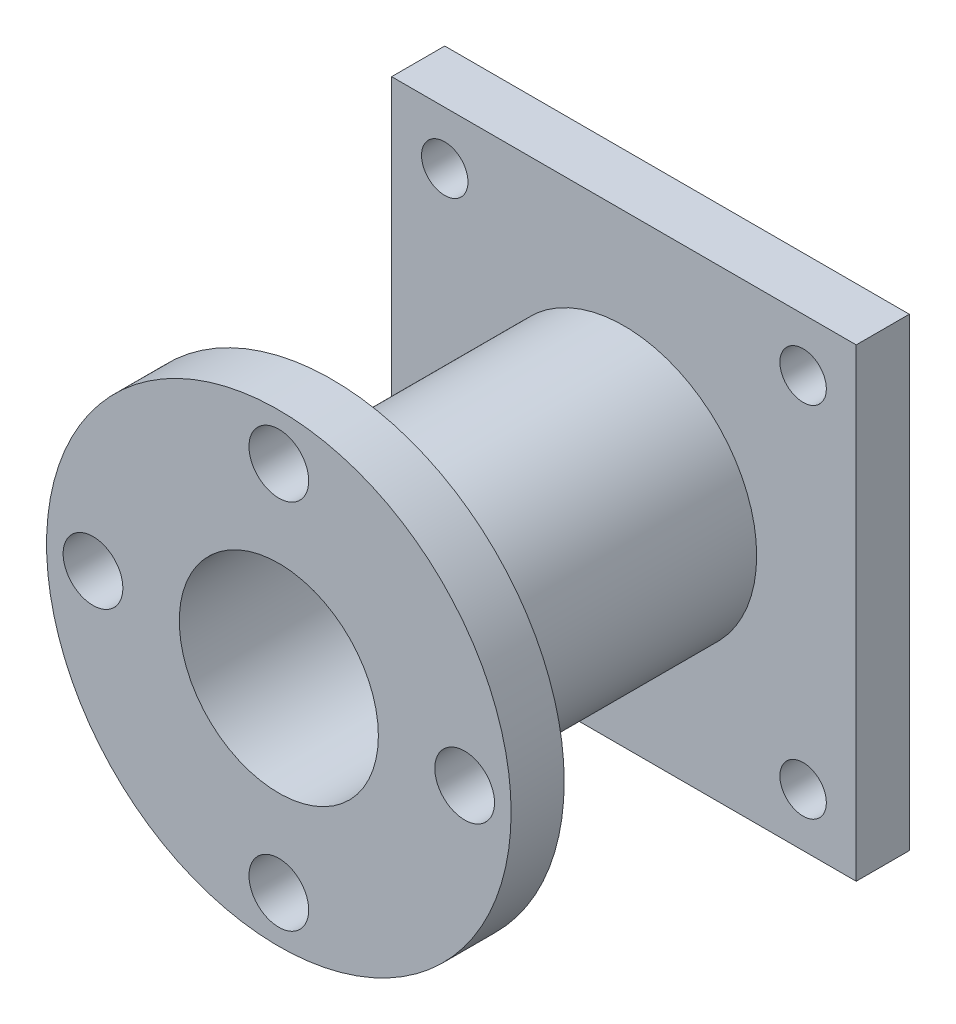
from build123d import *

# Parameters (mm, degrees)
SKETCH_1_R          = 20
EXTRUDE_1_DEPTH     = 60
SKETCH_2_W          = 70
SKETCH_2_H          = 70
EXTRUDE_2_DEPTH     = 8
SKETCH_3_R          = 35
EXTRUDE_3_DEPTH     = 8
SKETCH_4_R          = 15
CUT_EXTRUDE_1_DEPTH = 71
SKETCH_5_R          = 3.5
CUT_EXTRUDE_2_DEPTH = 8
SKETCH_6_R          = 4.5
CUT_EXTRUDE_3_DEPTH = 8


with BuildPart() as part:
    # 草图1 → 凸台-拉伸1 (new body)
    with BuildSketch(Plane.XY):
        Circle(SKETCH_1_R)
    extrude(amount=EXTRUDE_1_DEPTH)

    # 草图2 → 凸台-拉伸2 (add)
    with BuildSketch(Plane.XY):
        Rectangle(SKETCH_2_W, SKETCH_2_H)
    extrude(amount=EXTRUDE_2_DEPTH)

    # 草图3 → 凸台-拉伸3 (add)
    with BuildSketch(Plane.XY.offset(52)):
        Circle(SKETCH_3_R)
    extrude(amount=EXTRUDE_3_DEPTH)

    # 草图4 → 切除-拉伸1 (cut, symmetric)
    with BuildSketch(Plane.XY):
        Circle(SKETCH_4_R)
    extrude(amount=CUT_EXTRUDE_1_DEPTH, both=True, mode=Mode.SUBTRACT)

    # 草图5 → 切除-拉伸2 (cut)
    with BuildSketch(Plane.XY):
        with Locations((27, 27)):
            Circle(SKETCH_5_R)
        with Locations((-27, 27)):
            Circle(SKETCH_5_R)
        with Locations((-27, -27)):
            Circle(SKETCH_5_R)
        with Locations((27, -27)):
            Circle(SKETCH_5_R)
    extrude(amount=CUT_EXTRUDE_2_DEPTH, mode=Mode.SUBTRACT)

    # 草图6 → 切除-拉伸3 (cut)
    with BuildSketch(Plane.XY.offset(60)):
        with Locations((28, 0)):
            Circle(SKETCH_6_R)
        with Locations((0, 28)):
            Circle(SKETCH_6_R)
        with Locations((-28, 0)):
            Circle(SKETCH_6_R)
        with Locations((0, -28)):
            Circle(SKETCH_6_R)
    extrude(amount=-CUT_EXTRUDE_3_DEPTH, mode=Mode.SUBTRACT)


solid = part.part
